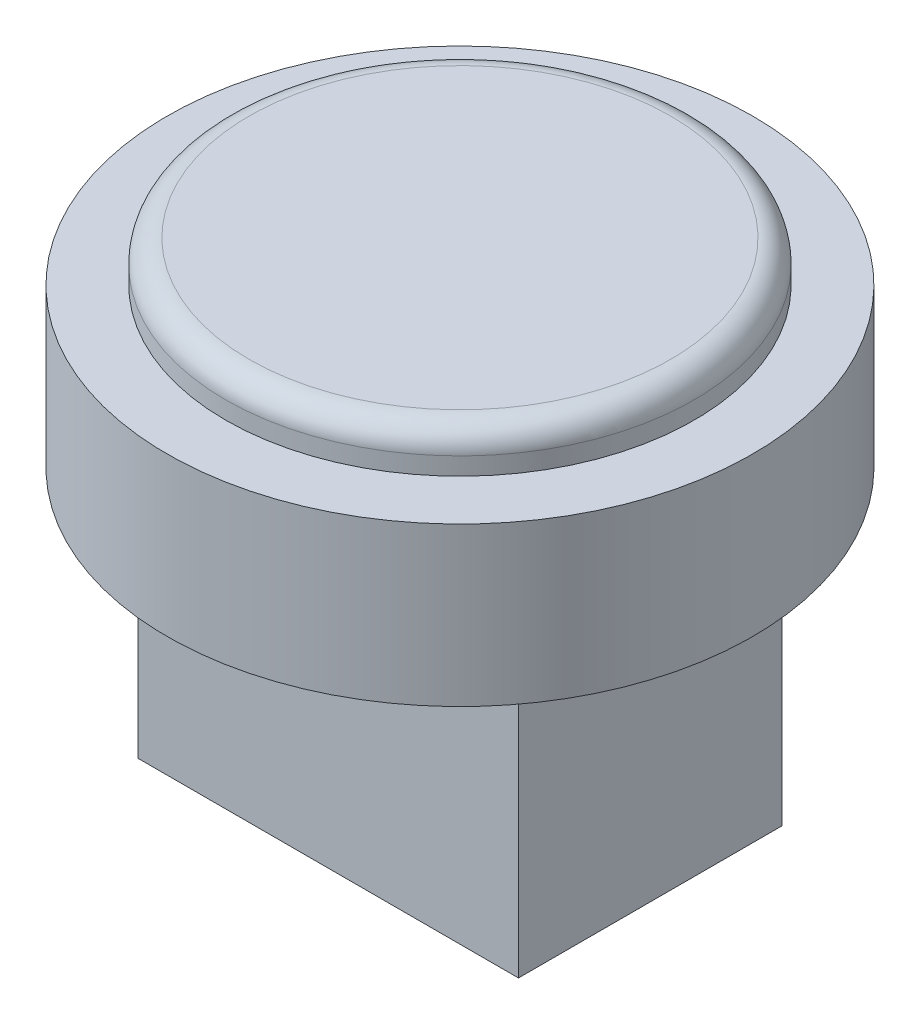
from build123d import *

# Parameters (mm, degrees)
SKETCH1_R           = 5
BOSS_EXTRUDE1_DEPTH = 2.7
SKETCH2_R           = 4
BOSS_EXTRUDE2_DEPTH = 0.7
FILLET1_R           = 0.4
SKETCH3_W           = 6.5
SKETCH3_H           = 4.5
BOSS_EXTRUDE3_DEPTH = 4.8


with BuildPart() as part:
    # Sketch1 → Boss-Extrude1 (new body)
    with BuildSketch(Plane(origin=(0, 0, 0), x_dir=(1, 0, 0), z_dir=(0, 1, 0))):
        with Locations(Location((0, 0, 0), (0, 0, 90))):
            Circle(SKETCH1_R)
    extrude(amount=BOSS_EXTRUDE1_DEPTH)

    # Sketch2 → Boss-Extrude2 (add)
    with BuildSketch(Plane(origin=(0, 2.7, 0), x_dir=(1, 0, 0), z_dir=(0, 1, 0))):
        with Locations(Location((0, 0, 0), (0, 0, 270))):
            Circle(SKETCH2_R)
    extrude(amount=BOSS_EXTRUDE2_DEPTH)

    # Fillet1
    fillet1_edges = [part.edges().sort_by_distance(p)[0] for p in [
        (0, 3.4, -4),
    ]]
    fillet(fillet1_edges, radius=FILLET1_R)

    # Sketch3 → Boss-Extrude3 (add)
    with BuildSketch(Plane.XZ):
        Rectangle(SKETCH3_W, SKETCH3_H)
    extrude(amount=BOSS_EXTRUDE3_DEPTH)


solid = part.part
